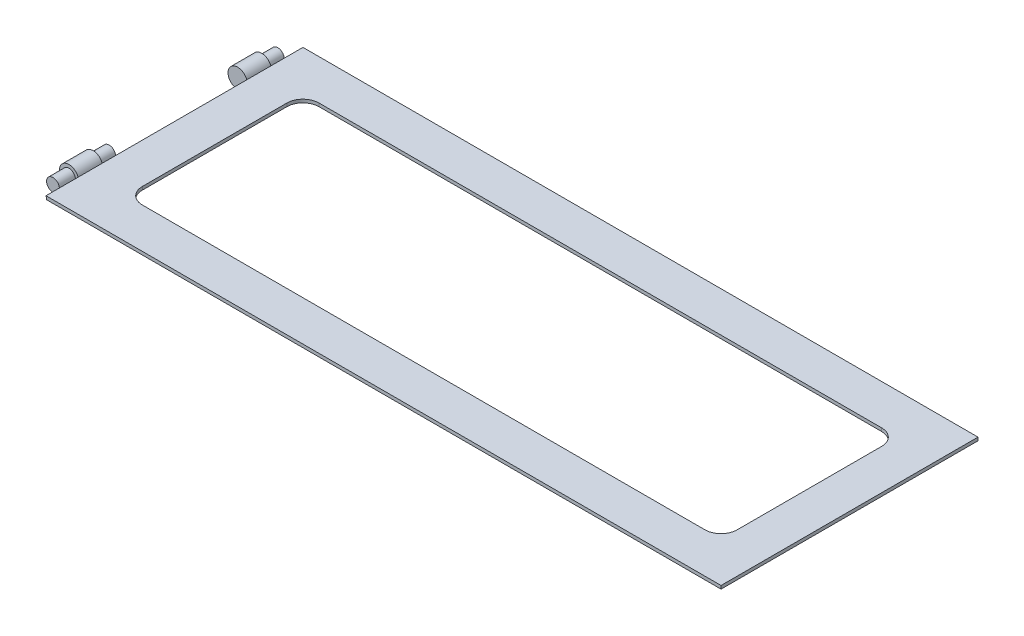
from build123d import *

# Parameters (mm, degrees)
SKETCH3_R           = 2
BOSS_EXTRUDE2_DEPTH = 80
SKETCH3_18_R        = 3
SKETCH3_18_R_2      = 2
CUT_EXTRUDE1_DEPTH  = 5
BOSS_EXTRUDE3_START = -5
SKETCH3_19_R        = 2
BOSS_EXTRUDE3_DEPTH = 75
CUT_EXTRUDE2_START  = -5
SKETCH3_20_R        = 3
SKETCH3_20_R_2      = 2
CUT_EXTRUDE2_DEPTH  = 5
CUT_EXTRUDE3_START  = -17.5
SKETCH3_21_R        = 3
SKETCH3_21_R_2      = 2
CUT_EXTRUDE3_DEPTH  = 5
CUT_EXTRUDE4_START  = -22.5
SKETCH3_22_R        = 3
CUT_EXTRUDE4_DEPTH  = 35
CUT_EXTRUDE5_START  = -57.5
SKETCH3_23_R        = 3
SKETCH3_23_R_2      = 2
CUT_EXTRUDE5_DEPTH  = 5
CUT_EXTRUDE8_START  = -70
SKETCH3_26_R        = 3
SKETCH3_26_R_2      = 2
CUT_EXTRUDE8_DEPTH  = 5
CUT_EXTRUDE9_START  = -75
SKETCH3_27_R        = 3
CUT_EXTRUDE9_DEPTH  = 5
SKETCH4_W           = 185.171572875
SKETCH4_H           = 55
CUT_EXTRUDE10_DEPTH = 228.563178041
CUT_EXTRUDE11_START = -57.5
SKETCH3_28_R        = 2
CUT_EXTRUDE11_DEPTH = 5
FILLET4_R           = 5


with BuildPart() as part:
    # Sketch3 → Boss-Extrude2 (new body)
    with BuildSketch(Plane.XY):
        with BuildLine():
            ThreePointArc((2.828427125, 1), (-2.956795679, -0.507305936), (3, 0))
            Line((3, 0), (213, 0))
            Line((213, 0), (213, 1))
            Line((213, 1), (2.828427125, 1))
        make_face()
        Circle(SKETCH3_R, mode=Mode.SUBTRACT)
    extrude(amount=-BOSS_EXTRUDE2_DEPTH)

    # Sketch3<18> → Cut-Extrude1 (cut)
    with BuildSketch(Plane.XY):
        Circle(SKETCH3_18_R)
        Circle(SKETCH3_18_R_2, mode=Mode.SUBTRACT)
    extrude(amount=-CUT_EXTRUDE1_DEPTH, mode=Mode.SUBTRACT)

    # Sketch3<19> → Boss-Extrude3 (add)
    with BuildSketch(Plane.XY.offset(BOSS_EXTRUDE3_START)):
        Circle(SKETCH3_19_R)
    extrude(amount=-BOSS_EXTRUDE3_DEPTH)

    # Sketch3<20> → Cut-Extrude2 (cut)
    with BuildSketch(Plane.XY.offset(CUT_EXTRUDE2_START)):
        Circle(SKETCH3_20_R)
        Circle(SKETCH3_20_R_2, mode=Mode.SUBTRACT)
    extrude(amount=-CUT_EXTRUDE2_DEPTH, mode=Mode.SUBTRACT)

    # Sketch3<21> → Cut-Extrude3 (cut)
    with BuildSketch(Plane.XY.offset(CUT_EXTRUDE3_START)):
        Circle(SKETCH3_21_R)
        Circle(SKETCH3_21_R_2, mode=Mode.SUBTRACT)
    extrude(amount=-CUT_EXTRUDE3_DEPTH, mode=Mode.SUBTRACT)

    # Sketch3<22> → Cut-Extrude4 (cut)
    with BuildSketch(Plane.XY.offset(CUT_EXTRUDE4_START)):
        Circle(SKETCH3_22_R)
    extrude(amount=-CUT_EXTRUDE4_DEPTH, mode=Mode.SUBTRACT)

    # Sketch3<23> → Cut-Extrude5 (cut)
    with BuildSketch(Plane.XY.offset(CUT_EXTRUDE5_START)):
        Circle(SKETCH3_23_R)
        Circle(SKETCH3_23_R_2, mode=Mode.SUBTRACT)
    extrude(amount=-CUT_EXTRUDE5_DEPTH, mode=Mode.SUBTRACT)

    # Sketch3<26> → Cut-Extrude8 (cut)
    with BuildSketch(Plane.XY.offset(CUT_EXTRUDE8_START)):
        Circle(SKETCH3_26_R)
        Circle(SKETCH3_26_R_2, mode=Mode.SUBTRACT)
    extrude(amount=-CUT_EXTRUDE8_DEPTH, mode=Mode.SUBTRACT)

    # Sketch3<27> → Cut-Extrude9 (cut)
    with BuildSketch(Plane.XY.offset(CUT_EXTRUDE9_START)):
        Circle(SKETCH3_27_R)
    extrude(amount=-CUT_EXTRUDE9_DEPTH, mode=Mode.SUBTRACT)

    # Sketch4 → Cut-Extrude10 (cut, through all)
    with BuildSketch(Plane(origin=(0, 1, 0), x_dir=(1, 0, 0), z_dir=(0, 1, 0))):
        with Locations((107.914213562, 40)):
            Rectangle(SKETCH4_W, SKETCH4_H)
    extrude(amount=-CUT_EXTRUDE10_DEPTH, mode=Mode.SUBTRACT)

    # Sketch3<28> → Cut-Extrude11 (cut)
    with BuildSketch(Plane.XY.offset(CUT_EXTRUDE11_START)):
        Circle(SKETCH3_28_R)
    extrude(amount=-CUT_EXTRUDE11_DEPTH, mode=Mode.SUBTRACT)

    # Fillet4
    fillet4_edges = [part.edges().sort_by_distance(p)[0] for p in [
        (200.5, 0.5, -12.5),
        (200.5, 0.5, -67.5),
        (15.328427125, 0.5, -12.5),
        (15.328427125, 0.5, -67.5),
    ]]
    fillet(fillet4_edges, radius=FILLET4_R)


solid = part.part
